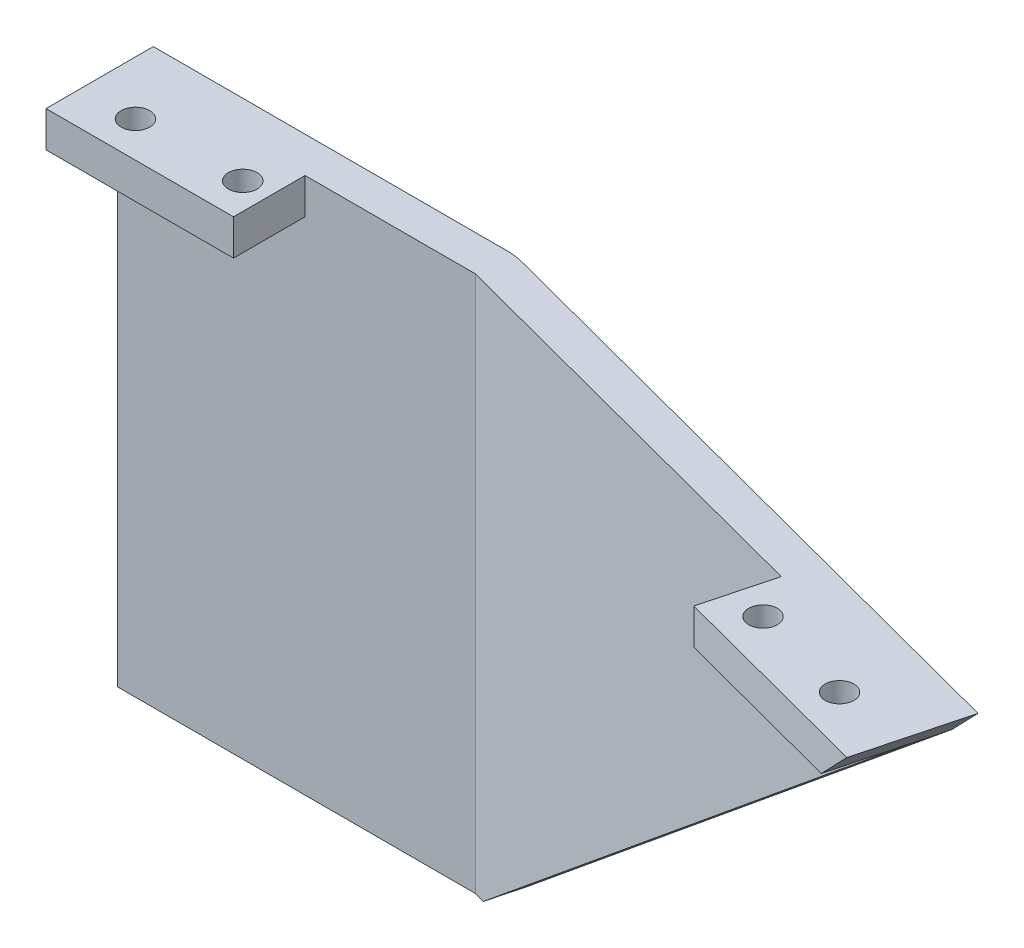
from build123d import *

# Parameters (mm, degrees)
SKETCH_1_W          = 50
SKETCH_1_H          = 150
EXTRUDE_1_DEPTH     = 10
SKETCH_4_W          = 10
SKETCH_4_H          = 150
EXTRUDE_2_DEPTH     = 280
EXTRUDE_3_DEPTH     = 10
CUT_EXTRUDE_2_DEPTH = 50
EXTRUDE_4_DEPTH     = 50
SKETCH_11_R         = 4
CUT_EXTRUDE_3_DEPTH = 30
CUT_EXTRUDE_4_DEPTH = 10


with BuildPart() as part:
    # 草图1 → 凸台-拉伸1 (new body)
    with BuildSketch(Plane.XY):
        Rectangle(SKETCH_1_W, SKETCH_1_H)
    extrude(amount=EXTRUDE_1_DEPTH)



with BuildPart() as body_2:
    # 草图4 → 凸台-拉伸2 (new body)
    with BuildSketch(Plane(origin=(25, 75, 10), x_dir=(0.25449329927964387, 0, -0.9670745372626465), z_dir=(0.9670745372626464, 0, 0.2544932992796438))):
        with Locations((5, -75)):
            Rectangle(SKETCH_4_W, SKETCH_4_H)
    extrude(amount=EXTRUDE_2_DEPTH)


with BuildPart() as part_1:
    add(part.part)

    add(body_2.part)  # 放样1 merges body 2
    # 草图2 → 放样1 section 0
    with BuildSketch(Plane(origin=(25, 0, 0), x_dir=(0, 0, -1), z_dir=(1, 0, 0))):
        with BuildLine():
            Line((-10, 75), (0, 75))
            Line((0, 75), (0, -75))
            Line((0, -75), (-10, -75))
            Line((-10, -75), (-10, 75))
        make_face()
    # 草图5 → 放样1 section 1
    with BuildSketch(Plane(origin=(25.841968912, 0, 6.800518135), x_dir=(-0.2544932992796439, 0, 0.9670745372626465), z_dir=(-0.9670745372626464, 0, -0.25449329927964387))):
        with BuildLine():
            Line((-6.691587109, 75), (3.308412891, 75))
            Line((3.308412891, 75), (3.308412891, -75))
            Line((3.308412891, -75), (-6.691587109, -75))
            Line((-6.691587109, -75), (-6.691587109, 75))
        make_face()
    loft()

    # 草图7 → 凸台-拉伸3 (add)
    with BuildSketch(Plane(origin=(0, 75, 0), x_dir=(1, 0, 0), z_dir=(0, 1, 0))):
        Polygon((25, -10), (295.780870434, -81.258123798), (290.691004448, -100.599614544), (22.412469182, -30), (-25, -30), (-25, -10), align=None)
    extrude(amount=-EXTRUDE_3_DEPTH)

    # 草图8 → 切除-拉伸2 (cut, symmetric)
    with BuildSketch(Plane(origin=(-0.841968912, 0, 3.199481865), x_dir=(0.9670745372626465, 0, 0.25449329927964387), z_dir=(-0.2544932992796438, 0, 0.9670745372626464))):
        Polygon((26.721796424, -77.6469373), (-24.176863432, -75), (27.635711624, -109.174511974), (84.817327957, -109.174511974), (350.303403792, -101.880938462), (393.450387561, 75.498769348), (354.489240356, 81.573837192), (253.227147434, 121.301323399), (196.721796424, 65), align=None)
    extrude(amount=CUT_EXTRUDE_2_DEPTH, both=True, mode=Mode.SUBTRACT)

    # 草图10 → 凸台-拉伸4 (add)
    with BuildSketch(Plane.ZY.offset(25)):
        Polygon((0, 75), (0, -75), (10, -75), (10, 65), (30, 65), (30, 75), align=None)
    extrude(amount=EXTRUDE_4_DEPTH)

    # 草图11 → 切除-拉伸3 (cut)
    with BuildSketch(Plane.XZ.offset(-65)):
        with Locations(Location((-60, 20, 0), (0, 0, 270))):
            Circle(SKETCH_11_R)
        with Locations(Location((177.186992969, 60.389673257, 0), (0, 0, 270))):
            Circle(SKETCH_11_R)
        with Locations(Location((148.174756851, 52.754874279, 0), (0, 0, 270))):
            Circle(SKETCH_11_R)
        with Locations(Location((-30, 20, 0), (0, 0, 270))):
            Circle(SKETCH_11_R)
    extrude(amount=-CUT_EXTRUDE_3_DEPTH, mode=Mode.SUBTRACT)

    # 草图12 → 切除-拉伸4 (cut)
    with BuildSketch(Plane(origin=(0, 75, 0), x_dir=(1, 0, 0), z_dir=(0, 1, 0))):
        Polygon((-22.587530818, -30), (-22.587530818, -10), (25, -10), (141.048944472, -40.539195914), (135.959078486, -59.880686659), (22.412469182, -30), align=None)
    extrude(amount=-CUT_EXTRUDE_4_DEPTH, mode=Mode.SUBTRACT)


solid = part_1.part
